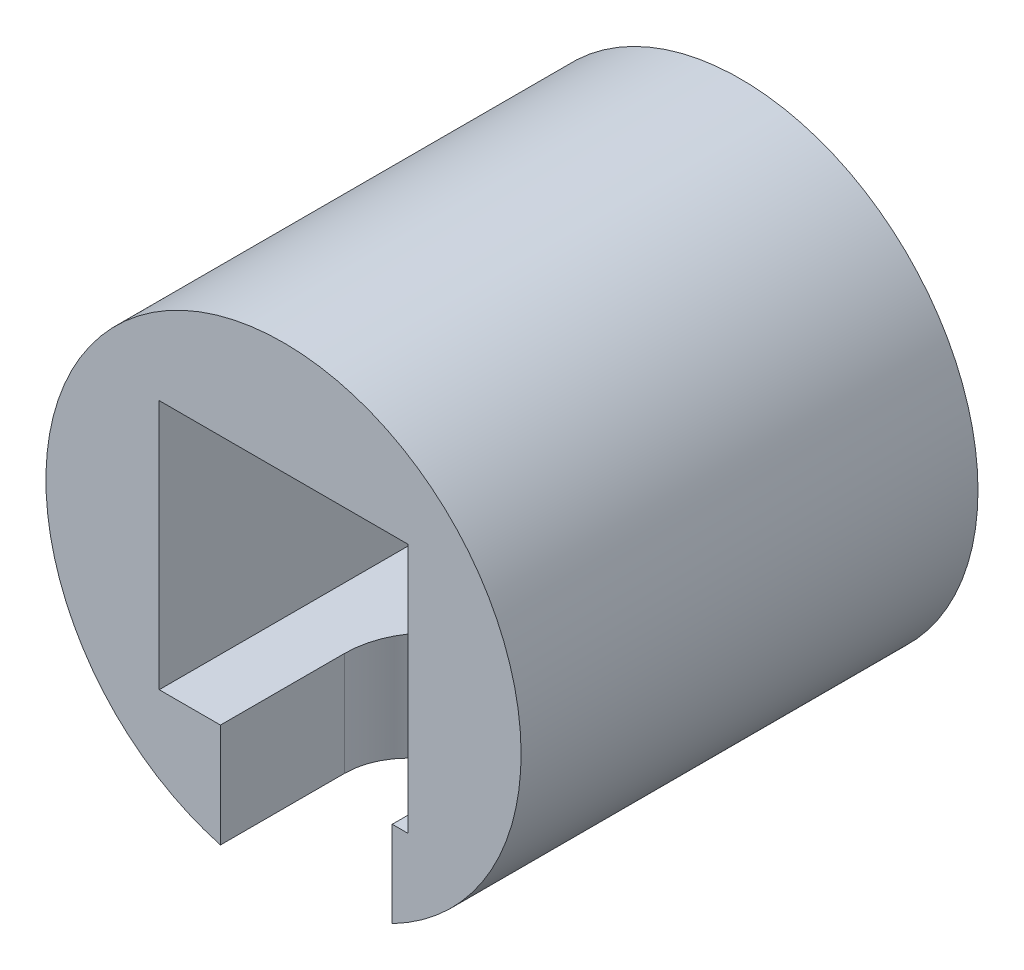
from build123d import *

# Parameters (mm, degrees)
SKETCH1_R               = 13
SKETCH1_R_2             = 3
BOSS_EXTRUDE1_DEPTH     = 25
CUT_EXTRUDE1_DEPTH      = 6.85
CUT_EXTRUDE2_REACH      = 33.032
CUT_EXTRUDE2_END_RADIUS = 13


with BuildPart() as part:
    # Sketch1 → Boss-Extrude1 (new body)
    with BuildSketch(Plane.XY):
        Circle(SKETCH1_R)
        Circle(SKETCH1_R_2, mode=Mode.SUBTRACT)
    extrude(amount=BOSS_EXTRUDE1_DEPTH)

    # Sketch2 → Cut-Extrude1 (cut, symmetric)
    with BuildSketch(Plane(origin=(0, 0, 0), x_dir=(1, 0, 0), z_dir=(0, 1, 0))):
        with BuildLine():
            Line((-6.8, -25), (6.8, -25))
            Line((6.8, -25), (6.8, -6.554936668))
            ThreePointArc((6.8, -6.554936668), (-0.224724758, -5.38457231), (-6.8, -8.119945437))
            Line((-6.8, -8.119945437), (-6.8, -25))
        make_face()
    extrude(amount=CUT_EXTRUDE1_DEPTH, both=True, mode=Mode.SUBTRACT)

    # Cut-Extrude2: up to this cylinder (the profile starts inside it)
    cut_extrude2_end = Plane(origin=(0, 0, 19.701869), z_dir=(0, 0, -1)) * Cylinder(CUT_EXTRUDE2_END_RADIUS, 93.064, mode=Mode.PRIVATE)
    # Sketch3 → Cut-Extrude2 (cut, up to the surface)
    with BuildSketch(Plane(origin=(0, 0, 0), x_dir=(1, 0, 0), z_dir=(0, 1, 0)), mode=Mode.PRIVATE) as cut_extrude2_sk1:
        with BuildLine():
            Line((-3.45, -18.2), (-3.45, -25))
            Line((-3.45, -25), (5.95, -25))
            Line((5.95, -25), (5.95, -18.2))
            ThreePointArc((5.95, -18.2), (1.25, -13.5), (-3.45, -18.2))
        make_face()
    cut_extrude2_tool1 = extrude(cut_extrude2_sk1.sketch, amount=-CUT_EXTRUDE2_REACH, mode=Mode.PRIVATE) & cut_extrude2_end
    add(cut_extrude2_tool1.solids().sort_by_distance((1.25, 0, 19.701869))[0], mode=Mode.SUBTRACT)


solid = part.part
